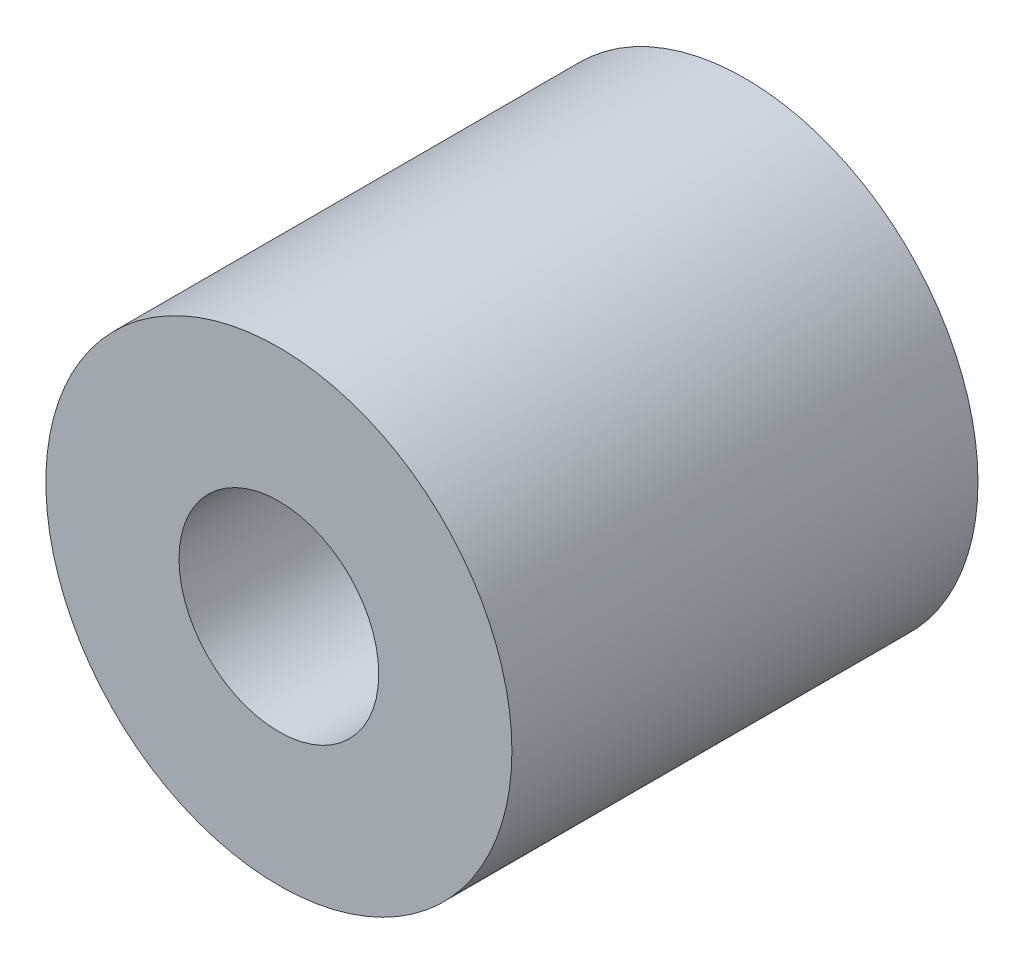
from build123d import *

# Parameters (mm, degrees)
SKETCH_1_R      = 3.5
SKETCH_1_R_2    = 1.5
EXTRUDE_1_DEPTH = 7


with BuildPart() as part:
    # 草图1 → 凸台-拉伸1 (new body)
    with BuildSketch(Plane.XY):
        Circle(SKETCH_1_R)
        Circle(SKETCH_1_R_2, mode=Mode.SUBTRACT)
    extrude(amount=EXTRUDE_1_DEPTH)


solid = part.part
